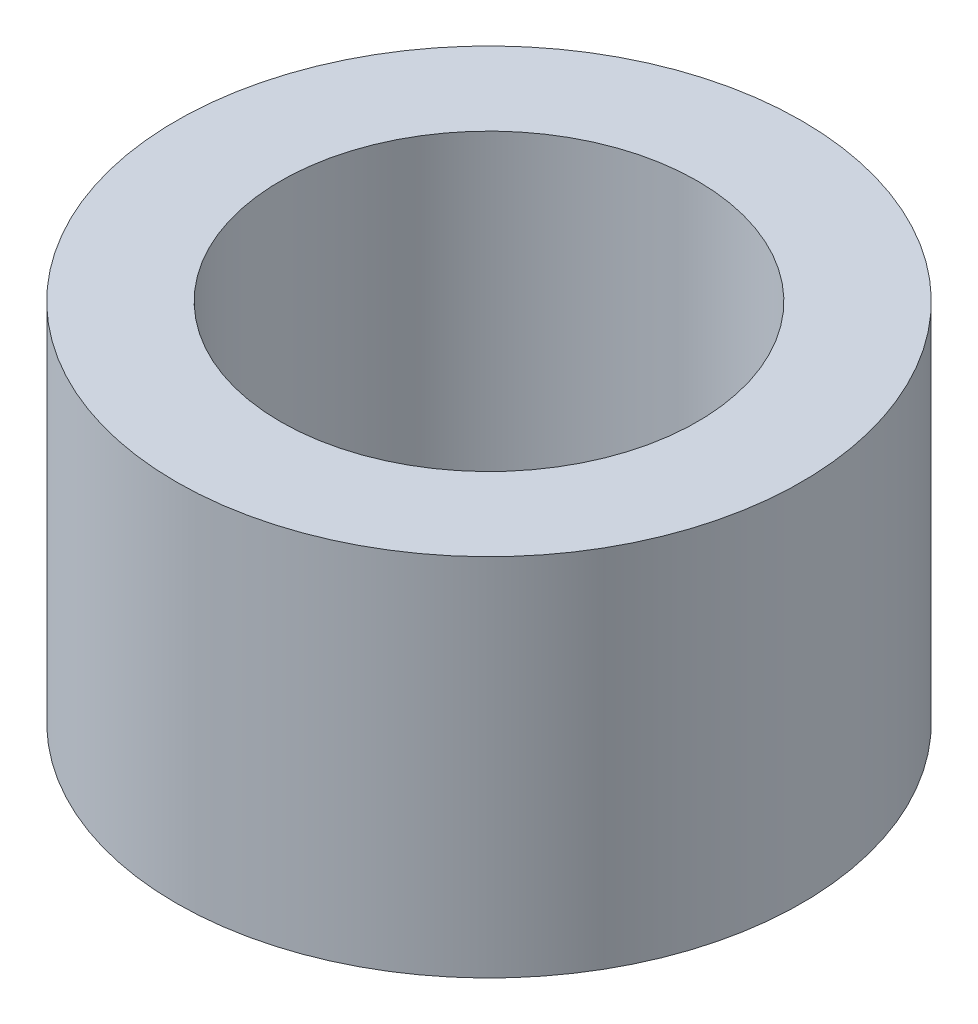
from build123d import *

# Parameters (mm, degrees)
SKETCH_1_R      = 3
SKETCH_1_R_2    = 2
EXTRUDE_1_DEPTH = 3.5


with BuildPart() as part:
    # Эскиз1 → Бобышка-Вытянуть1 (new body)
    with BuildSketch(Plane(origin=(0, 0, 0), x_dir=(1, 0, 0), z_dir=(0, 1, 0))):
        with Locations(Location((0, 0, 0), (0, 0, 270))):
            Circle(SKETCH_1_R)
        with Locations(Location((0, 0, 0), (0, 0, 270))):
            Circle(SKETCH_1_R_2, mode=Mode.SUBTRACT)
    extrude(amount=EXTRUDE_1_DEPTH)


solid = part.part
